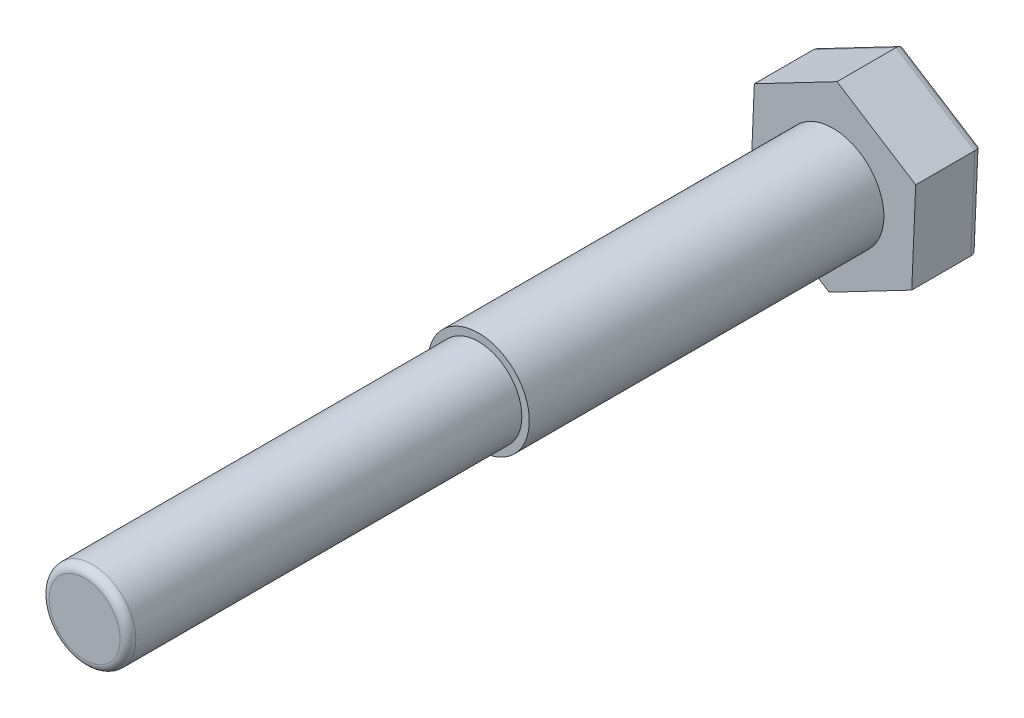
from build123d import *

# Parameters (mm, degrees)
EXTRUDE_275_DEPTH = 17
SKETCH_2_R        = 12.9
EXTRUDE_1_DEPTH   = 90
FILLET_3_R        = 2
SKETCH_3_R        = 11
EXTRUDE_2_DEPTH   = 100
FILLET_4_R        = 2


with BuildPart() as part:
    # 草图1 → Extrude 275 (new body)
    with BuildSketch(Plane.XY):
        Polygon((20.984201837, 10.954296262), (1.005402075, 23.65), (-19.978799762, 12.695703738), (-20.984201837, -10.954296262), (-1.005402075, -23.65), (19.978799762, -12.695703738), align=None)
    extrude(amount=EXTRUDE_275_DEPTH)

    # 草图2 → 凸台-拉伸1 (add)
    with BuildSketch(Plane.XY.offset(17)):
        with Locations(Location((0, 0, 0), (0, 0, 180))):
            Circle(SKETCH_2_R)
    extrude(amount=EXTRUDE_1_DEPTH)

    # 圆角3
    fillet_3_edges = [part.edges().sort_by_distance(p)[0] for p in [
        (9.486698843, -18.172851869, 0),
        (-10.994801956, -17.302148131, 0),
        (-20.4815008, 0.870703738, 0),
        (-9.486698843, 18.172851869, 0),
        (10.994801956, 17.302148131, 0),
        (20.4815008, -0.870703738, 0),
    ]]
    fillet(fillet_3_edges, radius=FILLET_3_R)

    # 草图3 → 凸台-拉伸2 (add)
    with BuildSketch(Plane.XY.offset(107)):
        Circle(SKETCH_3_R)
    extrude(amount=EXTRUDE_2_DEPTH)

    # 圆角4
    fillet_4_edges = [part.edges().sort_by_distance(p)[0] for p in [
        (-11, 0, 207),
    ]]
    fillet(fillet_4_edges, radius=FILLET_4_R)


solid = part.part
